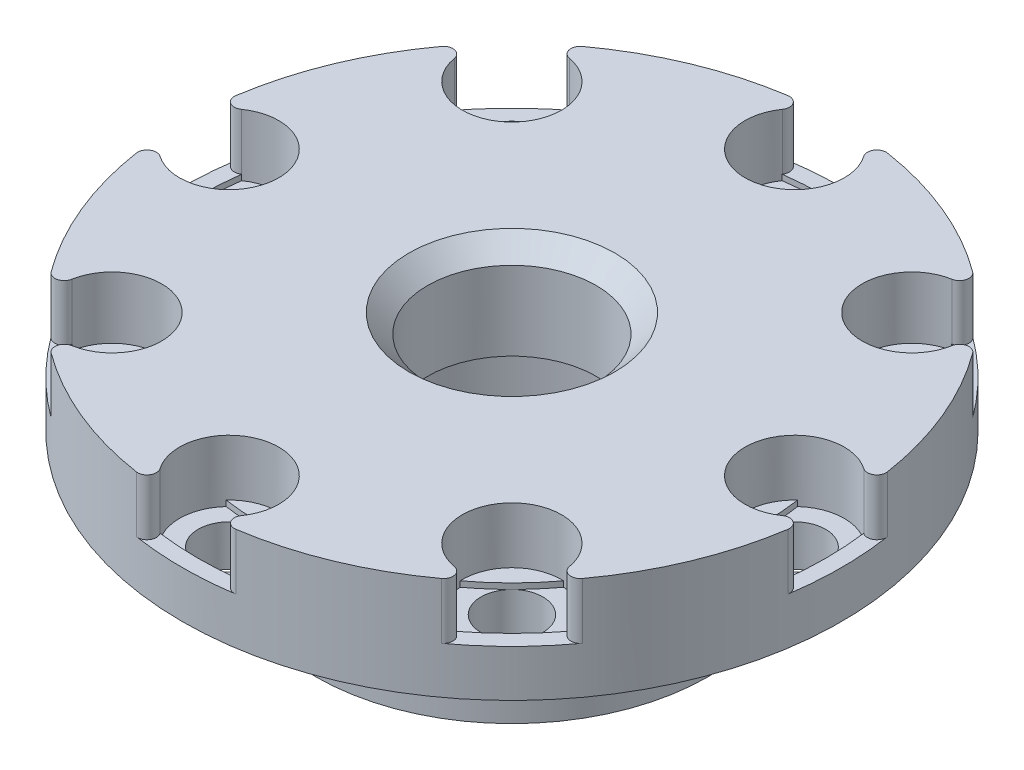
from build123d import *
from build123d.topology import SkipClean

# Parameters (mm, degrees)
SKETCH2_R           = 17.6
SKETCH2_R_2         = 1.65
BOSS_EXTRUDE1_DEPTH = 2.5
BOSS_EXTRUDE2_DEPTH = 3
FILLET1_R           = 0.5
SKETCH8_R           = 10.49
BOSS_EXTRUDE4_DEPTH = 5.5
SKETCH9_R           = 10.49
BOSS_EXTRUDE5_DEPTH = 11.6
SKETCH10_R          = 8.49
CUT_EXTRUDE2_DEPTH  = 6.4
CHAMFER3_SIZE       = 0.5
SKETCH11_R          = 4.5
CUT_EXTRUDE3_DEPTH  = 26.699805584
CHAMFER4_SIZE       = 1
CUT_EXTRUDE4_START  = -0.3
CUT_EXTRUDE4_DEPTH  = 0.3


with BuildPart() as part:
    # Sketch2 → Boss-Extrude1 (new body)
    with BuildSketch(Plane(origin=(0, 6.1, 0), x_dir=(1, 0, 0), z_dir=(0, 1, 0))):
        with Locations(Location((0, 0, 0), (0, 0, 270))):
            Circle(SKETCH2_R)
        with Locations(Location((0, 15.1, 0), (0, 0, 270))):
            Circle(SKETCH2_R_2, mode=Mode.SUBTRACT)
        with Locations(Location((10.677312396, 10.677312396, 0), (0, 0, 270))):
            Circle(SKETCH2_R_2, mode=Mode.SUBTRACT)
        with Locations(Location((15.1, 0, 0), (0, 0, 270))):
            Circle(SKETCH2_R_2, mode=Mode.SUBTRACT)
        with Locations(Location((10.677312396, -10.677312396, 0), (0, 0, 270))):
            Circle(SKETCH2_R_2, mode=Mode.SUBTRACT)
        with Locations(Location((0, -15.1, 0), (0, 0, 270))):
            Circle(SKETCH2_R_2, mode=Mode.SUBTRACT)
        with Locations(Location((-10.677312396, -10.677312396, 0), (0, 0, 270))):
            Circle(SKETCH2_R_2, mode=Mode.SUBTRACT)
        with Locations(Location((-15.1, 0, 0), (0, 0, 270))):
            Circle(SKETCH2_R_2, mode=Mode.SUBTRACT)
        with Locations(Location((-10.677312396, 10.677312396, 0), (0, 0, 270))):
            Circle(SKETCH2_R_2, mode=Mode.SUBTRACT)
    extrude(amount=BOSS_EXTRUDE1_DEPTH)

    # Sketch3 → Boss-Extrude2 (add)
    with SkipClean():  # the faces are left unmerged after this step: merging them gives an invalid solid
        with BuildSketch(Plane(origin=(0, 8.6, 0), x_dir=(1, 0, 0), z_dir=(0, 1, 0))):
            with BuildLine():
                ThreePointArc((-13.097716556, 11.756267308), (-12.495622077, 8.749554656), (-9.458885704, 8.324030348))
                ThreePointArc((-9.458885704, 8.324030348), (-8.28945078, 11.826493367), (-11.756267308, 13.097716556))
                ThreePointArc((-11.756267308, 13.097716556), (-6.73522841, 16.260279772), (-0.948547859, 17.57442053))
                ThreePointArc((-0.948547859, 17.57442053), (-2.648869676, 15.022608535), (-0.802463918, 12.57442053))
                ThreePointArc((-0.802463918, 12.57442053), (2.501066798, 14.224120516), (0.948547859, 17.57442053))
                ThreePointArc((0.948547859, 17.57442053), (6.73522841, 16.260279772), (11.756267308, 13.097716556))
                ThreePointArc((11.756267308, 13.097716556), (8.749554656, 12.495622077), (8.324030348, 9.458885704))
                ThreePointArc((8.324030348, 9.458885704), (11.826493367, 8.28945078), (13.097716556, 11.756267308))
                ThreePointArc((13.097716556, 11.756267308), (16.260279772, 6.73522841), (17.57442053, 0.948547859))
                ThreePointArc((17.57442053, 0.948547859), (15.022608535, 2.648869676), (12.57442053, 0.802463918))
                ThreePointArc((12.57442053, 0.802463918), (14.224120516, -2.501066798), (17.57442053, -0.948547859))
                ThreePointArc((17.57442053, -0.948547859), (16.260279772, -6.73522841), (13.097716556, -11.756267308))
                ThreePointArc((13.097716556, -11.756267308), (12.495622077, -8.749554656), (9.458885704, -8.324030348))
                ThreePointArc((9.458885704, -8.324030348), (8.28945078, -11.826493367), (11.756267308, -13.097716556))
                ThreePointArc((11.756267308, -13.097716556), (6.73522841, -16.260279772), (0.948547859, -17.57442053))
                ThreePointArc((0.948547859, -17.57442053), (2.501066798, -14.224120516), (-0.802463918, -12.57442053))
                ThreePointArc((-0.802463918, -12.57442053), (-2.648869676, -15.022608535), (-0.948547859, -17.57442053))
                ThreePointArc((-0.948547859, -17.57442053), (-6.73522841, -16.260279772), (-11.756267308, -13.097716556))
                ThreePointArc((-11.756267308, -13.097716556), (-8.28945078, -11.826493367), (-9.458885704, -8.324030348))
                ThreePointArc((-9.458885704, -8.324030348), (-12.495622077, -8.749554656), (-13.097716556, -11.756267308))
                ThreePointArc((-13.097716556, -11.756267308), (-16.260279772, -6.73522841), (-17.57442053, -0.948547859))
                ThreePointArc((-17.57442053, -0.948547859), (-14.224120516, -2.501066798), (-12.57442053, 0.802463918))
                ThreePointArc((-12.57442053, 0.802463918), (-15.022608535, 2.648869676), (-17.57442053, 0.948547859))
                ThreePointArc((-17.57442053, 0.948547859), (-16.260279772, 6.73522841), (-13.097716556, 11.756267308))
            make_face()
        extrude(amount=BOSS_EXTRUDE2_DEPTH)

    # Fillet1
    fillet1_edges = [part.edges().sort_by_distance(p)[0] for p in [
        (-17.57442053, 10.1, -0.948547859),
        (-17.57442053, 10.1, 0.948547859),
        (-13.097716556, 10.1, 11.756267308),
        (-11.756267308, 10.1, 13.097716556),
        (-0.948547859, 10.1, 17.57442053),
        (0.948547859, 10.1, 17.57442053),
        (11.756267308, 10.1, 13.097716556),
        (13.097716556, 10.1, 11.756267308),
        (17.57442053, 10.1, 0.948547859),
        (17.57442053, 10.1, -0.948547859),
        (13.097716556, 10.1, -11.756267308),
        (11.756267308, 10.1, -13.097716556),
        (0.948547859, 10.1, -17.57442053),
        (-0.948547859, 10.1, -17.57442053),
        (-11.756267308, 10.1, -13.097716556),
        (-13.097716556, 10.1, -11.756267308),
    ]]
    fillet(fillet1_edges, radius=FILLET1_R)

    # Sketch8 → Boss-Extrude4 (add)
    with SkipClean():  # the faces are left unmerged after this step: merging them gives an invalid solid
        with BuildSketch(Plane(origin=(0, 11.6, 0), x_dir=(1, 0, 0), z_dir=(0, 1, 0))):
            Circle(SKETCH8_R)
        extrude(amount=-BOSS_EXTRUDE4_DEPTH)

    # Sketch9 → Boss-Extrude5 (add)
    with SkipClean():  # the faces are left unmerged after this step: merging them gives an invalid solid
        with BuildSketch(Plane(origin=(0, 11.6, 0), x_dir=(1, 0, 0), z_dir=(0, 1, 0))):
            with Locations(Location((0, 0, 0), (0, 0, 270))):
                Circle(SKETCH9_R)
        extrude(amount=-BOSS_EXTRUDE5_DEPTH)

    # Sketch10 → Cut-Extrude2 (cut)
    with SkipClean():  # the faces are left unmerged after this step: merging them gives an invalid solid
        with BuildSketch(Plane.XZ):
            with Locations(Location((0, 0, 0), (0, 0, 270))):
                Circle(SKETCH10_R)
        extrude(amount=-CUT_EXTRUDE2_DEPTH, mode=Mode.SUBTRACT)

    # Chamfer3
    chamfer3_edges = [part.edges().sort_by_distance(p)[0] for p in [
        (0, 0, 8.49),
    ]]
    chamfer(chamfer3_edges, length=CHAMFER3_SIZE)

    # Sketch11 → Cut-Extrude3 (cut, through all)
    with SkipClean():  # the faces are left unmerged after this step: merging them gives an invalid solid
        with BuildSketch(Plane.XZ.offset(-6.4)):
            with Locations(Location((0, 0, 0), (0, 0, 270))):
                Circle(SKETCH11_R)
        extrude(amount=-CUT_EXTRUDE3_DEPTH, mode=Mode.SUBTRACT)

    # Chamfer4
    chamfer4_edges = [part.edges().sort_by_distance(p)[0] for p in [
        (0, 11.6, 4.5),
    ]]
    chamfer(chamfer4_edges, length=CHAMFER4_SIZE)

    # Sketch12 → Cut-Extrude4 (cut)
    with SkipClean():  # the faces are left unmerged after this step: merging them gives an invalid solid
        with BuildSketch(Plane(origin=(0, 8.6, 0), x_dir=(1, 0, 0), z_dir=(0, 1, 0)).offset(CUT_EXTRUDE4_START)):
            with BuildLine():
                ThreePointArc((16.607615894, -2.179356399), (16.75, 0), (16.607615894, 2.179356399))
                ThreePointArc((16.607615894, 2.179356399), (14.917766848, 2.64372674), (13.307615894, 1.951886067))
                ThreePointArc((13.307615894, 1.951886067), (13.45, 0), (13.307615894, -1.951886067))
                ThreePointArc((13.307615894, -1.951886067), (14.917766848, -2.64372674), (16.607615894, -2.179356399))
            make_face()
            with BuildLine():
                ThreePointArc((8.029713566, -10.790097314), (9.510586207, -9.510586207), (10.790097314, -8.029713566))
                ThreePointArc((10.790097314, -8.029713566), (12.417851204, -8.679056993), (13.284395507, -10.202320129))
                ThreePointArc((13.284395507, -10.202320129), (11.844038585, -11.844038585), (10.202320129, -13.284395507))
                ThreePointArc((10.202320129, -13.284395507), (8.679056993, -12.417851204), (8.029713566, -10.790097314))
            make_face()
            with BuildLine():
                ThreePointArc((-1.951886067, -13.307615894), (0, -13.45), (1.951886067, -13.307615894))
                ThreePointArc((1.951886067, -13.307615894), (2.64372674, -14.917766848), (2.179356399, -16.607615894))
                ThreePointArc((2.179356399, -16.607615894), (0, -16.75), (-2.179356399, -16.607615894))
                ThreePointArc((-2.179356399, -16.607615894), (-2.64372674, -14.917766848), (-1.951886067, -13.307615894))
            make_face()
            with BuildLine():
                ThreePointArc((-10.790097314, -8.029713566), (-9.510586207, -9.510586207), (-8.029713566, -10.790097314))
                ThreePointArc((-8.029713566, -10.790097314), (-8.679056993, -12.417851204), (-10.202320129, -13.284395507))
                ThreePointArc((-10.202320129, -13.284395507), (-11.844038585, -11.844038585), (-13.284395507, -10.202320129))
                ThreePointArc((-13.284395507, -10.202320129), (-12.417851204, -8.679056993), (-10.790097314, -8.029713566))
            make_face()
            with BuildLine():
                ThreePointArc((-13.307615894, 1.951886067), (-13.45, 0), (-13.307615894, -1.951886067))
                ThreePointArc((-13.307615894, -1.951886067), (-14.917766848, -2.64372674), (-16.607615894, -2.179356399))
                ThreePointArc((-16.607615894, -2.179356399), (-16.75, 0), (-16.607615894, 2.179356399))
                ThreePointArc((-16.607615894, 2.179356399), (-14.917766848, 2.64372674), (-13.307615894, 1.951886067))
            make_face()
            with BuildLine():
                ThreePointArc((-8.029713566, 10.790097314), (-9.510586207, 9.510586207), (-10.790097314, 8.029713566))
                ThreePointArc((-10.790097314, 8.029713566), (-12.417851204, 8.679056993), (-13.284395507, 10.202320129))
                ThreePointArc((-13.284395507, 10.202320129), (-11.844038585, 11.844038585), (-10.202320129, 13.284395507))
                ThreePointArc((-10.202320129, 13.284395507), (-8.679056993, 12.417851204), (-8.029713566, 10.790097314))
            make_face()
            with BuildLine():
                ThreePointArc((1.951886067, 13.307615894), (0, 13.45), (-1.951886067, 13.307615894))
                ThreePointArc((-1.951886067, 13.307615894), (-2.64372674, 14.917766848), (-2.179356399, 16.607615894))
                ThreePointArc((-2.179356399, 16.607615894), (0, 16.75), (2.179356399, 16.607615894))
                ThreePointArc((2.179356399, 16.607615894), (2.64372674, 14.917766848), (1.951886067, 13.307615894))
            make_face()
            with BuildLine():
                ThreePointArc((10.790097314, 8.029713566), (9.510586207, 9.510586207), (8.029713566, 10.790097314))
                ThreePointArc((8.029713566, 10.790097314), (8.679056993, 12.417851204), (10.202320129, 13.284395507))
                ThreePointArc((10.202320129, 13.284395507), (11.844038585, 11.844038585), (13.284395507, 10.202320129))
                ThreePointArc((13.284395507, 10.202320129), (12.417851204, 8.679056993), (10.790097314, 8.029713566))
            make_face()
        extrude(amount=CUT_EXTRUDE4_DEPTH, mode=Mode.SUBTRACT)


solid = part.part
